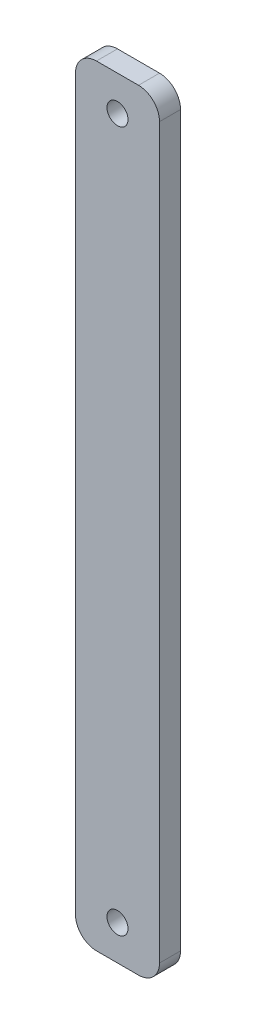
from build123d import *

# Parameters (mm, degrees)
CROQUIS1_R              = 1.5
SALIENTE_EXTRUIR1_DEPTH = 1.5


with BuildPart() as part:
    # Croquis1 → Saliente-Extruir1 (new, symmetric)
    with BuildSketch(Plane.XY):
        with BuildLine():
            Line((-3, -55), (3, -55))
            ThreePointArc((3, -55), (5.121320344, -54.121320344), (6, -52))
            Line((6, -52), (6, 52))
            ThreePointArc((6, 52), (5.121320344, 54.121320344), (3, 55))
            Line((3, 55), (-3, 55))
            ThreePointArc((-3, 55), (-5.121320344, 54.121320344), (-6, 52))
            Line((-6, 52), (-6, -52))
            ThreePointArc((-6, -52), (-5.121320344, -54.121320344), (-3, -55))
        make_face()
        with Locations((0, 50)):
            Circle(CROQUIS1_R, mode=Mode.SUBTRACT)
        with Locations(Location((0, -50, 0), (0, 0, 180))):
            Circle(CROQUIS1_R, mode=Mode.SUBTRACT)
    extrude(amount=SALIENTE_EXTRUIR1_DEPTH, both=True)


solid = part.part
